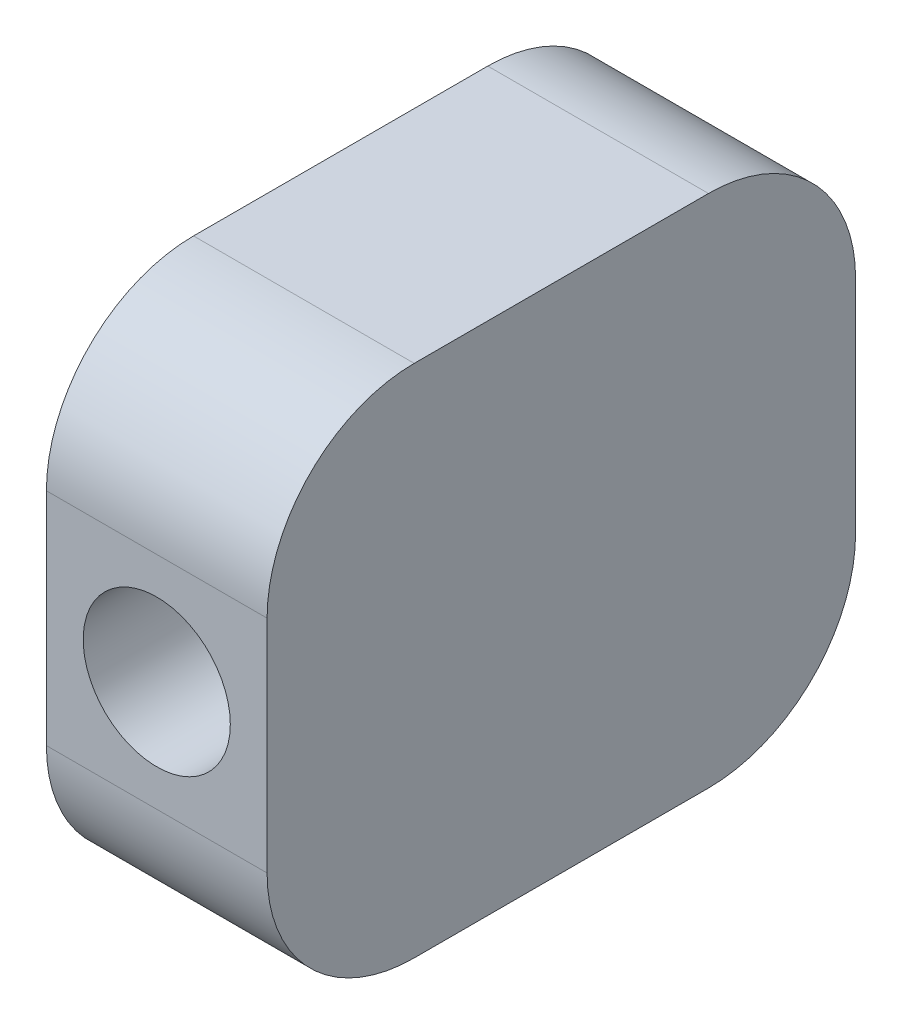
from build123d import *

# Parameters (mm, degrees)
SKETCH1_W           = 80
SKETCH1_H           = 70
BOSS_EXTRUDE1_DEPTH = 30
SKETCH2_R           = 10
CUT_EXTRUDE1_DEPTH  = 50
FILLET1_R           = 20
FILLET2_R           = 20
FILLET3_R           = 20
FILLET4_R           = 20


with BuildPart() as part:
    # Sketch1 → Boss-Extrude1 (new body)
    with BuildSketch(Plane(origin=(0, 0, 0), x_dir=(0, 0, -1), z_dir=(1, 0, 0))):
        Rectangle(SKETCH1_W, SKETCH1_H)
    extrude(amount=BOSS_EXTRUDE1_DEPTH)

    # Sketch2 → Cut-Extrude1 (cut)
    with BuildSketch(Plane.XY.offset(40)):
        with Locations((15, 0)):
            Circle(SKETCH2_R)
    extrude(amount=-CUT_EXTRUDE1_DEPTH, mode=Mode.SUBTRACT)

    # Fillet1
    fillet1_edges = [part.edges().sort_by_distance(p)[0] for p in [
        (15, 35, -40),
    ]]
    fillet(fillet1_edges, radius=FILLET1_R)

    # Fillet2
    fillet2_edges = [part.edges().sort_by_distance(p)[0] for p in [
        (15, -35, -40),
    ]]
    fillet(fillet2_edges, radius=FILLET2_R)

    # Fillet3
    fillet3_edges = [part.edges().sort_by_distance(p)[0] for p in [
        (15, -35, 40),
    ]]
    fillet(fillet3_edges, radius=FILLET3_R)

    # Fillet4
    fillet4_edges = [part.edges().sort_by_distance(p)[0] for p in [
        (15, 35, 40),
    ]]
    fillet(fillet4_edges, radius=FILLET4_R)


solid = part.part
